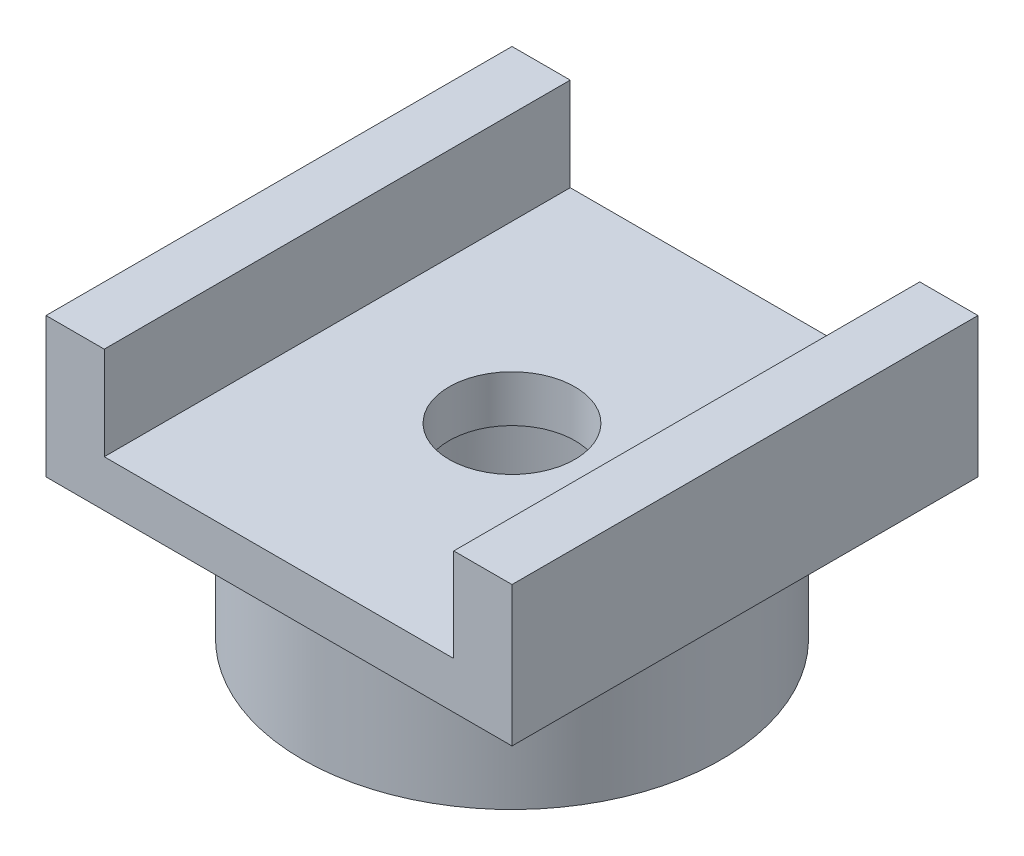
from build123d import *

# Parameters (mm, degrees)
ESQUISSE1_R        = 4.5
ESQUISSE1_R_2      = 2.75
BOSS_EXTRU_1_DEPTH = 3
ESQUISSE3_W        = 10
ESQUISSE3_H        = 10
ESQUISSE3_R        = 1.35
BOSS_EXTRU_2_DEPTH = 1
ESQUISSE4_W        = 1.25
ESQUISSE4_H        = 10
BOSS_EXTRU_3_DEPTH = 2


with BuildPart() as part:
    # Esquisse1 → Boss.-Extru.1 (new body)
    with BuildSketch(Plane(origin=(0, 0, 0), x_dir=(1, 0, 0), z_dir=(0, 1, 0))):
        with Locations(Location((0, 0, 0), (0, 0, 270))):
            Circle(ESQUISSE1_R)
        with Locations(Location((0, 0, 0), (0, 0, 270))):
            Circle(ESQUISSE1_R_2, mode=Mode.SUBTRACT)
    extrude(amount=-BOSS_EXTRU_1_DEPTH)

    # Esquisse3 → Boss.-Extru.2 (add)
    with BuildSketch(Plane(origin=(0, 0, 0), x_dir=(1, 0, 0), z_dir=(0, 1, 0))):
        Rectangle(ESQUISSE3_W, ESQUISSE3_H)
        with Locations(Location((0, 0, 0), (0, 0, 270))):
            Circle(ESQUISSE3_R, mode=Mode.SUBTRACT)
    extrude(amount=BOSS_EXTRU_2_DEPTH)

    # Esquisse4 → Boss.-Extru.3 (add)
    with BuildSketch(Plane(origin=(0, 1, 0), x_dir=(1, 0, 0), z_dir=(0, 1, 0))):
        with Locations((-4.375, 0)):
            Rectangle(ESQUISSE4_W, ESQUISSE4_H)
        with Locations((4.375, 0)):
            Rectangle(ESQUISSE4_W, ESQUISSE4_H)
    extrude(amount=BOSS_EXTRU_3_DEPTH)


solid = part.part
